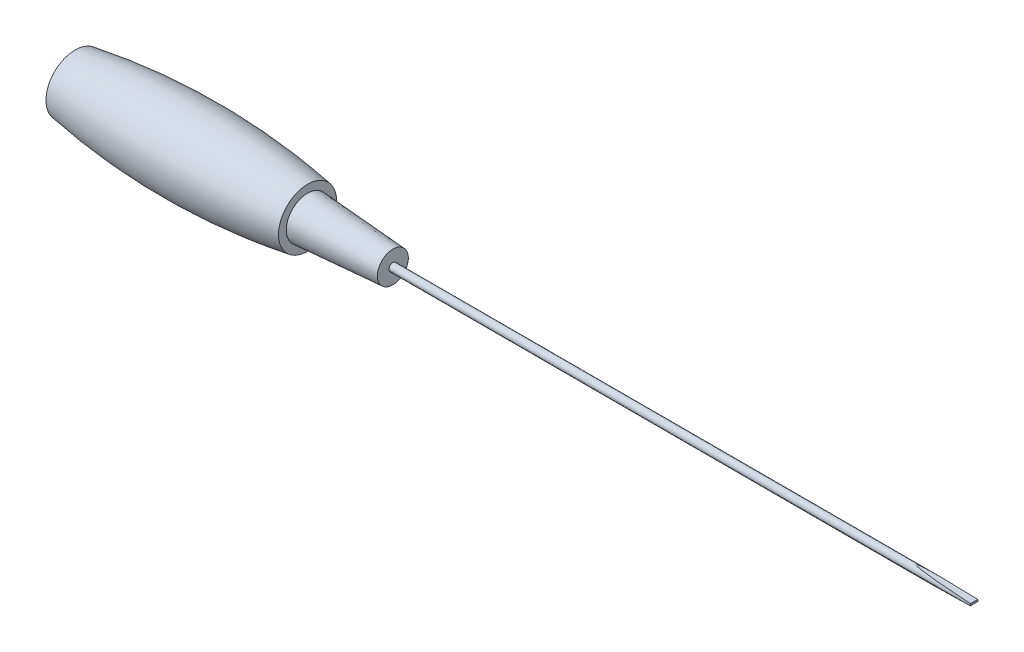
from build123d import *

# Parameters (mm, degrees)
SKETCH_3_R               = 1
EXTRUDE_1_DEPTH          = 150
CUT_EXTRUDE_2_DEPTH      = 201.73393304
CUT_EXTRUDE_2_DEPTH_BACK = 201.73393304


with BuildPart() as part:
    # 스케치2 → 회전2 (revolve)
    with BuildSketch(Plane.XY, mode=Mode.PRIVATE) as revolve_2_sk:
        with BuildLine():
            Line((26.921527792, -7.558606832), (26.921527792, -9.558606832))
            Line((26.921527792, -9.558606832), (48.921527792, -11.058606832))
            Line((48.921527792, -11.058606832), (48.921527792, -15.058606832))
            Line((48.921527792, -15.058606832), (-33.078472208, -15.058606832))
            Line((-33.078472208, -15.058606832), (-35.078472208, -15.058606832))
            ThreePointArc((-35.078472208, -15.058606832), (-34.599459562, -12.119156885), (-33.078472208, -9.558606832))
            Line((-33.078472208, -9.558606832), (-33.078472208, -7.558606832))
            ThreePointArc((-33.078472208, -7.558606832), (-3.078472208, -5.109969467), (26.921527792, -7.558606832))
        make_face()
    revolve(revolve_2_sk.sketch.rotate(Axis((-74.638312123, -15.058606832, 0), (1, 0, 0)), 90), axis=Axis((-74.638312123, -15.058606832, 0), (1, 0, 0)))

    # 스케치3 → 보스-돌출1 (add)
    with BuildSketch(Plane(origin=(48.921527792, 0, 0), x_dir=(0, 0, -1), z_dir=(1, 0, 0))):
        with Locations((0, -15.058606832)):
            Circle(SKETCH_3_R)
    extrude(amount=EXTRUDE_1_DEPTH)

    # 스케치5 → 컷-돌출2 (cut, two sides: drawn at the far end of the back side and taken through both)
    with BuildSketch(Plane.XY.offset(-CUT_EXTRUDE_2_DEPTH_BACK)):
        Polygon((198.921527792, -14.058606832), (183.921527792, -14.058606832), (198.921527792, -14.808606832), align=None)
        Polygon((198.921527792, -15.308606832), (198.921527792, -16.058606832), (183.921527792, -16.058606832), align=None)
    extrude(amount=CUT_EXTRUDE_2_DEPTH + CUT_EXTRUDE_2_DEPTH_BACK, mode=Mode.SUBTRACT)


solid = part.part
